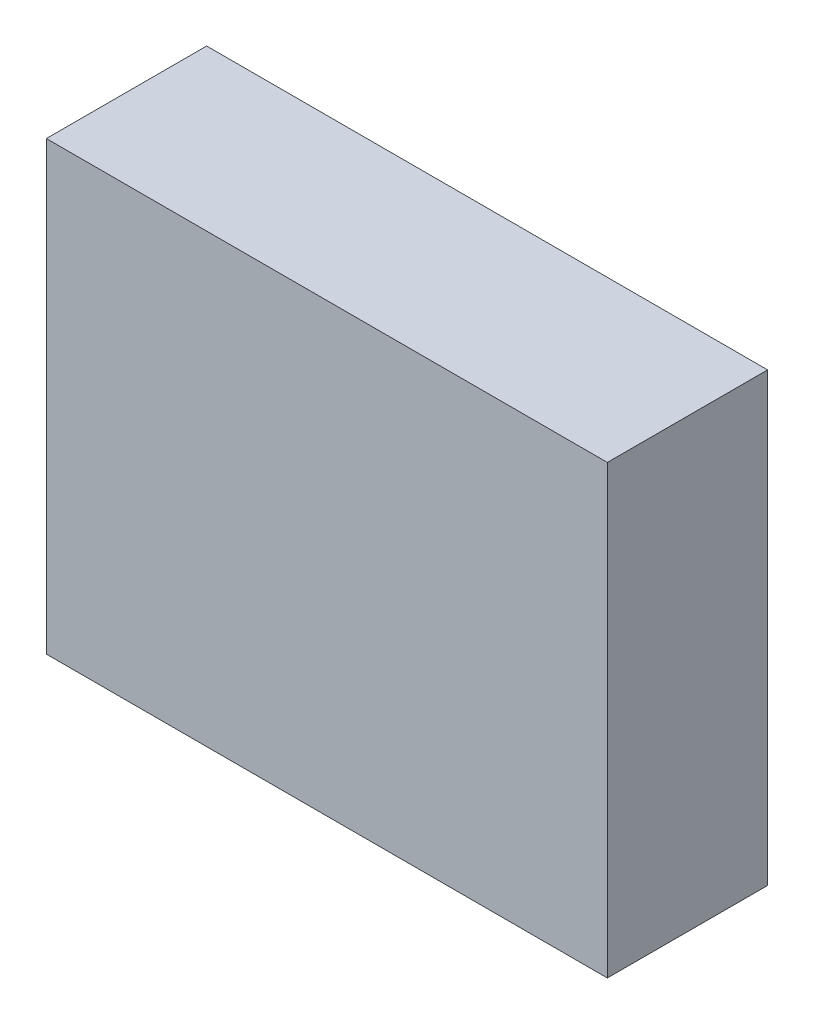
from build123d import *

# Parameters (mm, degrees)
BODY_W              = 4.9
BODY_H              = 3.9
BOSS_EXTRUDE1_DEPTH = 1.4


with BuildPart() as part:
    # Body → Boss-Extrude1 (new body)
    with BuildSketch(Plane.XY):
        Rectangle(BODY_W, BODY_H)
    extrude(amount=BOSS_EXTRUDE1_DEPTH)


solid = part.part
